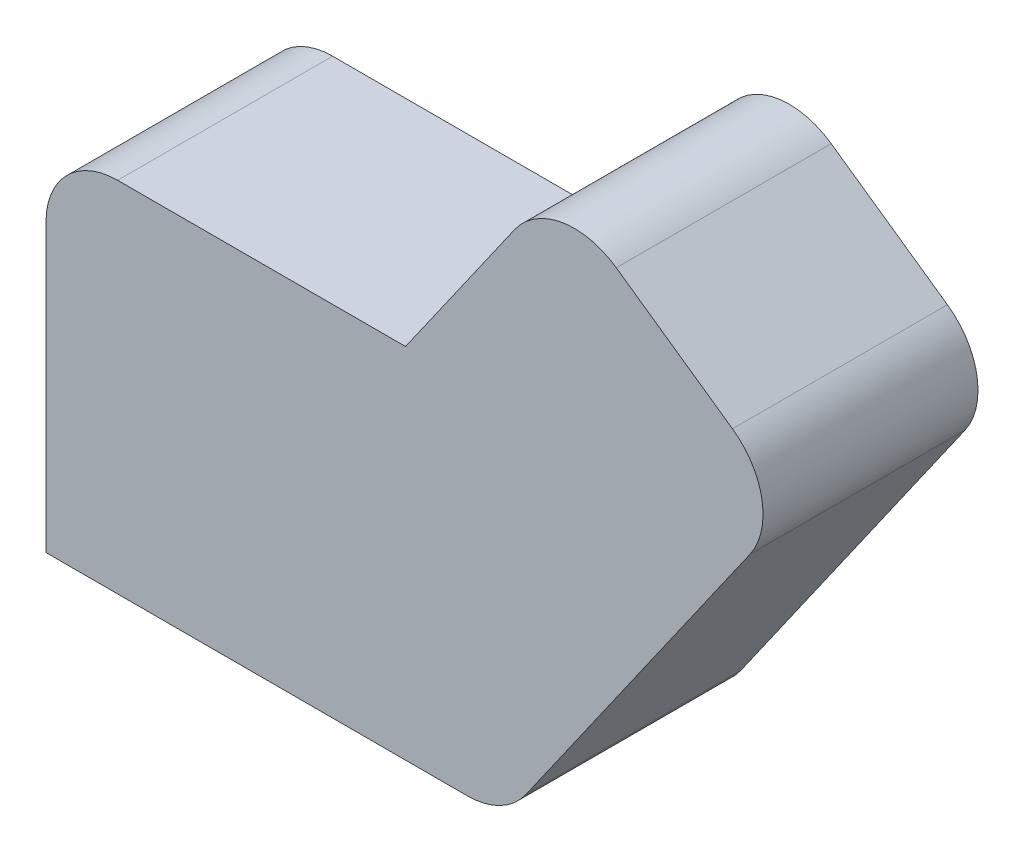
from build123d import *

# Parameters (mm, degrees)
EXTRUDE_1_DEPTH = 15
FILLET_1_R      = 5.1
FILLET_2_R      = 5
FILLET_3_R      = 5
FILLET_4_R      = 5


with BuildPart() as part:
    # 스케치1 → 보스-돌출1 (new body)
    with BuildSketch(Plane.XY):
        Polygon((0, 0), (32, 0), (52, 28.562960135), (35.616959114, 40.034488862), (25.08969668, 25), (0, 25), align=None)
    extrude(amount=EXTRUDE_1_DEPTH)

    # 필렛1
    fillet_1_edges = [part.edges().sort_by_distance(p)[0] for p in [
        (35.616959114, 40.034488862, 7.5),
    ]]
    fillet(fillet_1_edges, radius=FILLET_1_R)

    # 필렛2
    fillet_2_edges = [part.edges().sort_by_distance(p)[0] for p in [
        (32, 0, 7.5),
    ]]
    fillet(fillet_2_edges, radius=FILLET_2_R)

    # 필렛3
    fillet_3_edges = [part.edges().sort_by_distance(p)[0] for p in [
        (0, 25, 7.5),
    ]]
    fillet(fillet_3_edges, radius=FILLET_3_R)

    # 필렛4
    fillet_4_edges = [part.edges().sort_by_distance(p)[0] for p in [
        (52, 28.562960135, 7.5),
    ]]
    fillet(fillet_4_edges, radius=FILLET_4_R)


solid = part.part
